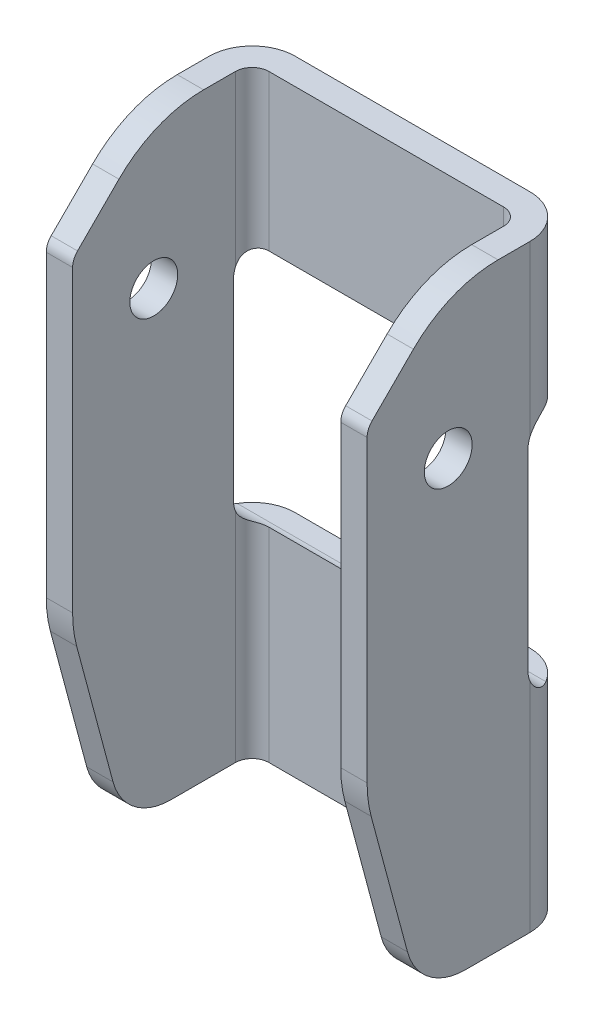
from build123d import *

# Parameters (mm, degrees)
SKETCH1_W               = 34.036
SKETCH1_H               = 63.5
BOSS_EXTRUDE1_DEPTH     = 21.844
CUT_EXTRUDE1_DEPTH      = 43.12879253
CUT_EXTRUDE1_DEPTH_BACK = 43.12879253
CUT_EXTRUDE2_DEPTH      = 43.12879253
CUT_EXTRUDE2_DEPTH_BACK = 43.12879253
SKETCH3_R               = 2.54
FILLET1_R               = 12.7
FILLET2_R               = 6.35
FILLET3_R               = 1.778
FILLET4_R               = 4.572


with BuildPart() as part:
    # Sketch1 → Boss-Extrude1 (new body)
    with BuildSketch(Plane.XY):
        Rectangle(SKETCH1_W, SKETCH1_H)
    extrude(amount=BOSS_EXTRUDE1_DEPTH)

    # Sketch2 → Cut-Extrude1 (cut, two sides: drawn at the far end of the back side and taken through both)
    with BuildSketch(Plane(origin=(0, 0, 0), x_dir=(1, 0, 0), z_dir=(0, 1, 0)).offset(-CUT_EXTRUDE1_DEPTH_BACK)):
        Polygon((14.224, -108.086321581), (14.224, -21.844), (14.224, -2.794), (-14.224, -2.794), (-14.224, -21.844), (-14.224, -108.086321581), (-14.224, -280.570964742), (14.224, -280.570964742), align=None)
    extrude(amount=CUT_EXTRUDE1_DEPTH + CUT_EXTRUDE1_DEPTH_BACK, mode=Mode.SUBTRACT)

    # Sketch3 → Cut-Extrude2 (cut, two sides: drawn at the far end of the back side and taken through both)
    with BuildSketch(Plane(origin=(0, 0, 0), x_dir=(0, 0, -1), z_dir=(1, 0, 0)).offset(-CUT_EXTRUDE2_DEPTH_BACK)):
        with Locations((-13.2334, 16.1544)):
            Circle(SKETCH3_R)
        with BuildLine():
            Line((-2.2352, 15.3162), (2.957237461, 15.3162))
            Line((2.957237461, 15.3162), (2.957237461, -10.1854))
            Line((2.957237461, -10.1854), (-2.2352, -10.1854))
            ThreePointArc((-2.2352, -10.1854), (-4.031251224, -9.441451224), (-4.7752, -7.6454))
            Line((-4.7752, -7.6454), (-4.7752, 12.7762))
            ThreePointArc((-4.7752, 12.7762), (-4.031251224, 14.572251224), (-2.2352, 15.3162))
        make_face()
        Polygon((-13.208, 31.75), (-21.844, 23.114), (-30.192518149, 23.114), (-30.192518149, 40.531352169), (-13.208, 40.531352169), align=None)
        Polygon((-16.256, -31.889517823), (-16.256, -43.289335124), (-30.986485738, -43.289335124), (-30.986485738, 4.366875898), (-25.970871418, 4.366875898), align=None)
    extrude(amount=CUT_EXTRUDE2_DEPTH + CUT_EXTRUDE2_DEPTH_BACK, mode=Mode.SUBTRACT)

    # Fillet1
    fillet1_edges = [part.edges().sort_by_distance(p)[0] for p in [
        (15.621, 31.75, 13.208),
        (-15.621, 31.75, 13.208),
        (15.621, -11.034817911, 21.844),
        (-15.621, -11.034817911, 21.844),
    ]]
    fillet(fillet1_edges, radius=FILLET1_R)

    # Fillet2
    fillet2_edges = [part.edges().sort_by_distance(p)[0] for p in [
        (15.621, -31.75, 16.293383688),
        (-15.621, -31.75, 16.293383688),
    ]]
    fillet(fillet2_edges, radius=FILLET2_R)

    # Fillet3
    fillet3_edges = [part.edges().sort_by_distance(p)[0] for p in [
        (15.621, 23.114, 21.844),
        (14.224, -20.936584837, 2.794),
        (14.224, 23.501984837, 2.794),
        (-14.224, -20.936584837, 2.794),
        (-14.224, 23.501984837, 2.794),
        (-15.621, 23.114, 21.844),
    ]]
    fillet(fillet3_edges, radius=FILLET3_R)

    # Fillet4
    fillet4_edges = [part.edges().sort_by_distance(p)[0] for p in [
        (17.018, 23.5331, 0),
        (17.018, -20.9677, 0),
        (-17.018, 23.5331, 0),
        (-17.018, -20.9677, 0),
    ]]
    fillet(fillet4_edges, radius=FILLET4_R)


solid = part.part
